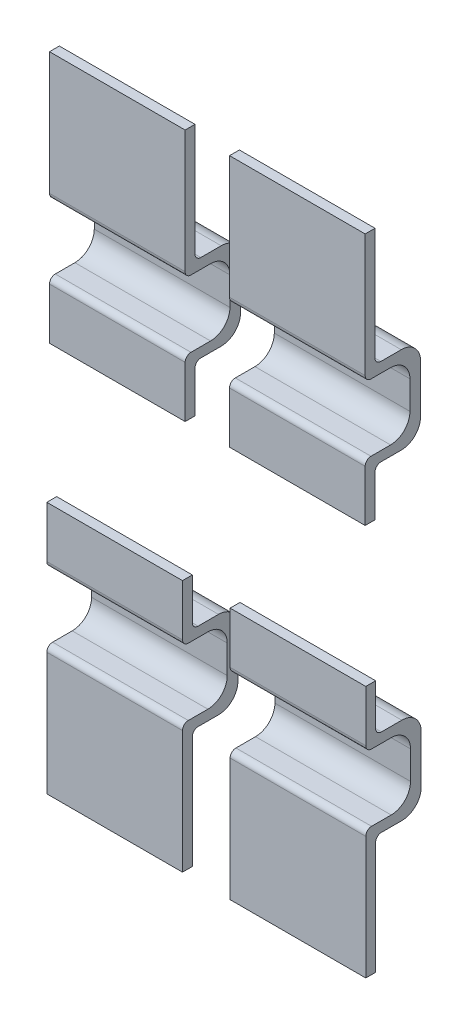
from build123d import *

# Parameters (mm, degrees)
EXTRUDE_1_DEPTH   = 7
MOVE_BODY_9_ANGLE = 180


with BuildPart() as part:
    # 草图1 → 凸台-拉伸1 (new body)
    with BuildSketch(Plane(origin=(0, 0, 0), x_dir=(0, 0, -1), z_dir=(1, 0, 0))):
        with BuildLine():
            ThreePointArc((5.062213222, 22.091789195), (5.150081188, 22.303921229), (5.362213222, 22.391789195))
            Line((5.362213222, 22.391789195), (6.372689254, 22.391789195))
            ThreePointArc((6.372689254, 22.391789195), (7.079796035, 22.684682414), (7.372689254, 23.391789195))
            Line((7.372689254, 23.391789195), (7.372689254, 24.846057412))
            ThreePointArc((7.372689254, 24.846057412), (7.079796035, 25.553164194), (6.372689254, 25.846057412))
            Line((6.372689254, 25.846057412), (5.362213222, 25.846057412))
            ThreePointArc((5.362213222, 25.846057412), (5.150081188, 25.933925378), (5.062213222, 26.146057412))
            Line((5.062213222, 26.146057412), (5.062213222, 32.476164579))
            Line((5.062213222, 32.476164579), (5.570906071, 32.476164579))
            Line((5.570906071, 32.476164579), (5.570906071, 26.67391983))
            ThreePointArc((5.570906071, 26.67391983), (5.658774037, 26.461787796), (5.870906071, 26.37391983))
            Line((5.870906071, 26.37391983), (6.921987381, 26.37391983))
            ThreePointArc((6.921987381, 26.37391983), (7.629094162, 26.081026611), (7.921987381, 25.37391983))
            Line((7.921987381, 25.37391983), (7.921987381, 22.883090361))
            ThreePointArc((7.921987381, 22.883090361), (7.629094162, 22.17598358), (6.921987381, 21.883090361))
            Line((6.921987381, 21.883090361), (5.870906071, 21.883090361))
            ThreePointArc((5.870906071, 21.883090361), (5.658774037, 21.795222396), (5.570906071, 21.583090361))
            Line((5.570906071, 21.583090361), (5.570906071, 20.466629913))
            Line((5.570906071, 20.466629913), (5.570906071, 19.755616612))
            Line((5.570906071, 19.755616612), (5.570906071, 19.44499473))
            Line((5.570906071, 19.44499473), (5.062213222, 19.44499473))
            Line((5.062213222, 19.44499473), (5.062213222, 22.091789195))
        make_face()
    extrude(amount=EXTRUDE_1_DEPTH)


with BuildPart() as part_1:
    # Move Body 3: moved
    add(part.part.moved(Location((7.155712978, 0, 0))))


with BuildPart() as body_2:
    # Move Body 4: copy of part
    add(part_1.part.moved(Location((9.290885399, 0, 0))))


with BuildPart() as body_3:
    # Move Body 5: copy of part
    add(part_1.part.moved(Location((-0.137540576, -16.530787364, 0))))


with BuildPart() as body_3_1:
    # Move Body 9: moved
    add(body_3.part.rotate(Axis((10.518172402, 9.429792291, 0), (0, 0, 1)), MOVE_BODY_9_ANGLE))


with BuildPart() as body_3_2:
    # Move Body 10: moved
    add(body_3_1.part.moved(Location((0, -3.675931743, 0))))


with BuildPart() as body_4:
    # Move Body 11: copy of body 3
    add(body_3_2.part.moved(Location((9.458710269, 0, 0))))


solid = Compound([part_1.part, body_2.part, body_3_2.part, body_4.part])
